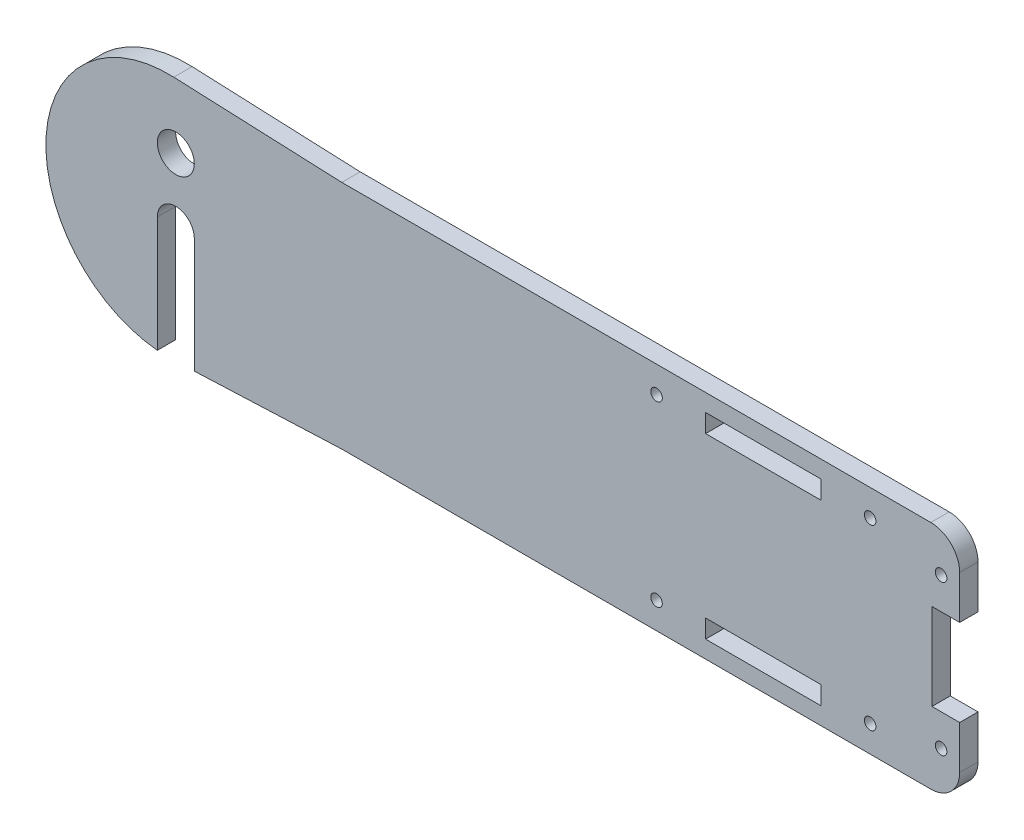
from build123d import *

# Parameters (mm, degrees)
BOSS_EXTRUDE1_DEPTH     = 3.175
CUT_EXTRUDE1_DEPTH      = 135.971128857
CUT_EXTRUDE1_DEPTH_BACK = 135.971128857
SKETCH3_R               = 3.2
SKETCH6_R               = 1
SKETCH6_W               = 20
SKETCH6_H               = 3.175
CUT_EXTRUDE4_DEPTH      = 135.971128857
CUT_EXTRUDE5_DEPTH      = 135.971128857
CUT_EXTRUDE5_DEPTH_BACK = 135.971128857
SKETCH7_R               = 1
SKETCH7_W               = 4.8
SKETCH7_H               = 15
FILLET2_R               = 5
FILLET3_R               = 5
CUT_EXTRUDE6_DEPTH      = 135.971128857
CUT_EXTRUDE6_DEPTH_BACK = 135.971128857


with BuildPart() as part:
    # Sketch1 → Boss-Extrude1 (new body)
    with BuildSketch(Plane.XY):
        with BuildLine():
            Line((-111.101926123, 21.231014185), (-82, 20))
            Line((-82, 20), (25, 20))
            Line((25, 20), (25, -20))
            Line((25, -20), (-82, -20))
            Line((-82, -20), (-111.101926123, -21.231014185))
            ThreePointArc((-111.101926123, -21.231014185), (-133.25, 0), (-111.101926123, 21.231014185))
        make_face()
    extrude(amount=-BOSS_EXTRUDE1_DEPTH)

    # Sketch3 → Cut-Extrude1 (cut, two sides: drawn at the far end of the back side and taken through both)
    with BuildSketch(Plane.XY.offset(-CUT_EXTRUDE1_DEPTH_BACK)):
        with Locations((-110.75, 10)):
            Circle(SKETCH3_R)
    extrude(amount=CUT_EXTRUDE1_DEPTH + CUT_EXTRUDE1_DEPTH_BACK, mode=Mode.SUBTRACT)

    # Sketch6 → Cut-Extrude4 (cut, symmetric)
    with BuildSketch(Plane.XY):
        with Locations((9.5, 15.4125)):
            Circle(SKETCH6_R)
        with Locations((-27.5, 15.4125)):
            Circle(SKETCH6_R)
        with Locations((-9, 15.4125)):
            Rectangle(SKETCH6_W, SKETCH6_H)
    cut_extrude4 = extrude(amount=CUT_EXTRUDE4_DEPTH, both=True, mode=Mode.SUBTRACT)

    # Mirror1: Cut-Extrude4 across plane
    add(cut_extrude4.mirror(Plane.ZX), mode=Mode.SUBTRACT)

    # Sketch7 → Cut-Extrude5 (cut, two sides: drawn at the far end of the back side and taken through both)
    with BuildSketch(Plane.XY.offset(-CUT_EXTRUDE5_DEPTH_BACK)):
        with Locations((21.7875, 13)):
            Circle(SKETCH7_R)
        with Locations((21.7875, -13)):
            Circle(SKETCH7_R)
        with Locations((22.6, 0)):
            Rectangle(SKETCH7_W, SKETCH7_H)
    extrude(amount=CUT_EXTRUDE5_DEPTH + CUT_EXTRUDE5_DEPTH_BACK, mode=Mode.SUBTRACT)

    # Fillet2
    fillet2_edges = [part.edges().sort_by_distance(p)[0] for p in [
        (25, 20, -1.5875),
    ]]
    fillet(fillet2_edges, radius=FILLET2_R)

    # Fillet3
    fillet3_edges = [part.edges().sort_by_distance(p)[0] for p in [
        (25, -20, -1.5875),
    ]]
    fillet(fillet3_edges, radius=FILLET3_R)

    # Sketch8 → Cut-Extrude6 (cut, two sides: drawn at the far end of the back side and taken through both)
    with BuildSketch(Plane.XY.offset(-CUT_EXTRUDE6_DEPTH_BACK)):
        with BuildLine():
            Line((-107.55, -21.080767379), (-107.55, -1.160340262))
            ThreePointArc((-107.55, -1.160340262), (-110.75, 2.039659738), (-113.95, -1.160340262))
            Line((-113.95, -1.160340262), (-113.95, -21.160340262))
            ThreePointArc((-113.95, -21.160340262), (-112.527148786, -21.243460503), (-111.101926123, -21.231014185))
            Line((-111.101926123, -21.231014185), (-107.55, -21.080767379))
        make_face()
    extrude(amount=CUT_EXTRUDE6_DEPTH + CUT_EXTRUDE6_DEPTH_BACK, mode=Mode.SUBTRACT)


solid = part.part
